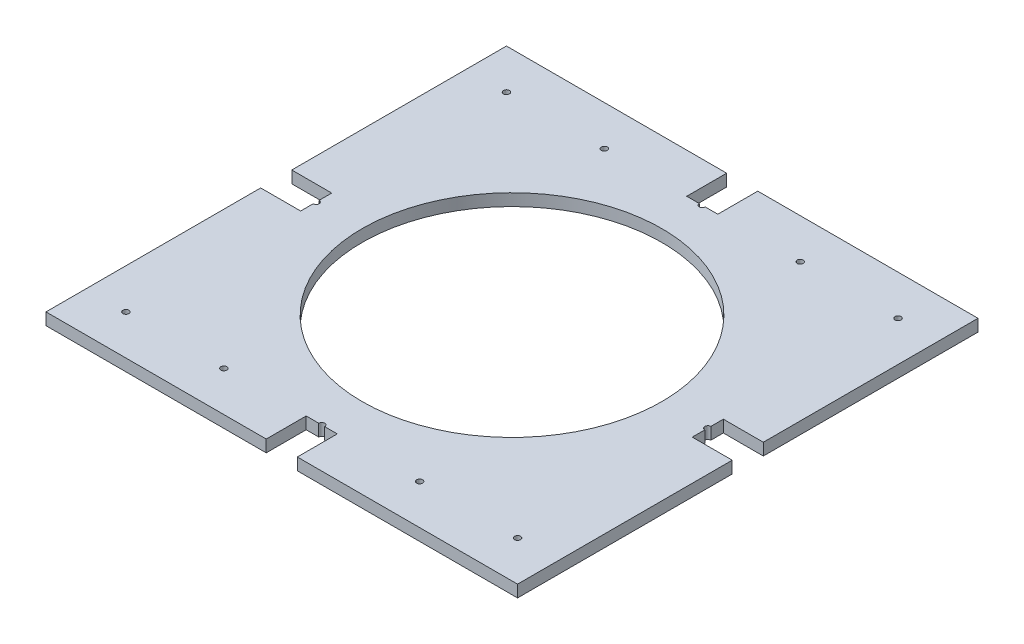
from build123d import *

# Parameters (mm, degrees)
SKETCH_1_R      = 1.5
SKETCH_1_R_2    = 75
EXTRUDE_1_DEPTH = 6


with BuildPart() as part:
    # 草图1 → 凸台-拉伸1 (new body)
    with BuildSketch(Plane(origin=(0, 0, 0), x_dir=(1, 0, 0), z_dir=(0, 1, 0))):
        with BuildLine():
            Line((-128, 125.225), (-17.78, 125.225))
            Line((-17.78, 125.225), (-17.78, 105.225))
            Line((-17.78, 105.225), (-15, 105.225))
            Line((-15, 105.225), (-11.5, 105.225))
            ThreePointArc((-11.5, 105.225), (-10, 103.725), (-8.5, 105.225))
            Line((-8.5, 105.225), (-5, 105.225))
            Line((-5, 105.225), (-2.22, 105.225))
            Line((-2.22, 105.225), (-2.22, 125.225))
            Line((-2.22, 125.225), (108, 125.225))
            Line((108, 125.225), (108, 17.78))
            Line((108, 17.78), (88, 17.78))
            Line((88, 17.78), (88, 15))
            Line((88, 15), (88, 11.5))
            ThreePointArc((88, 11.5), (86.5, 10), (88, 8.5))
            Line((88, 8.5), (88, 5))
            Line((88, 5), (88, 2.22))
            Line((88, 2.22), (108, 2.22))
            Line((108, 2.22), (108, -105.225))
            Line((108, -105.225), (-2.22, -105.225))
            Line((-2.22, -105.225), (-2.22, -85.225))
            Line((-2.22, -85.225), (-5, -85.225))
            Line((-5, -85.225), (-8.5, -85.225))
            ThreePointArc((-8.5, -85.225), (-10, -83.725), (-11.5, -85.225))
            Line((-11.5, -85.225), (-15, -85.225))
            Line((-15, -85.225), (-17.78, -85.225))
            Line((-17.78, -85.225), (-17.78, -105.225))
            Line((-17.78, -105.225), (-128, -105.225))
            Line((-128, -105.225), (-128, 2.22))
            Line((-128, 2.22), (-108, 2.22))
            Line((-108, 2.22), (-108, 5))
            Line((-108, 5), (-108, 8.5))
            ThreePointArc((-108, 8.5), (-106.5, 10), (-108, 11.5))
            Line((-108, 11.5), (-108, 15))
            Line((-108, 15), (-108, 17.78))
            Line((-108, 17.78), (-128, 17.78))
            Line((-128, 17.78), (-128, 125.225))
        make_face()
        with Locations(Location((-108, 105.225, 0), (0, 0, 270))):
            Circle(SKETCH_1_R, mode=Mode.SUBTRACT)
        with Locations(Location((-59, 105.225, 0), (0, 0, 270))):
            Circle(SKETCH_1_R, mode=Mode.SUBTRACT)
        with Locations(Location((39, 105.225, 0), (0, 0, 270))):
            Circle(SKETCH_1_R, mode=Mode.SUBTRACT)
        with Locations(Location((88, 105.225, 0), (0, 0, 270))):
            Circle(SKETCH_1_R, mode=Mode.SUBTRACT)
        with Locations(Location((-108, -85.225, 0), (0, 0, 270))):
            Circle(SKETCH_1_R, mode=Mode.SUBTRACT)
        with Locations(Location((-59, -85.225, 0), (0, 0, 270))):
            Circle(SKETCH_1_R, mode=Mode.SUBTRACT)
        with Locations(Location((39, -85.225, 0), (0, 0, 270))):
            Circle(SKETCH_1_R, mode=Mode.SUBTRACT)
        with Locations(Location((88, -85.225, 0), (0, 0, 270))):
            Circle(SKETCH_1_R, mode=Mode.SUBTRACT)
        with Locations(Location((-10, 10, 0), (0, 0, 270))):
            Circle(SKETCH_1_R_2, mode=Mode.SUBTRACT)
    extrude(amount=EXTRUDE_1_DEPTH)


solid = part.part
